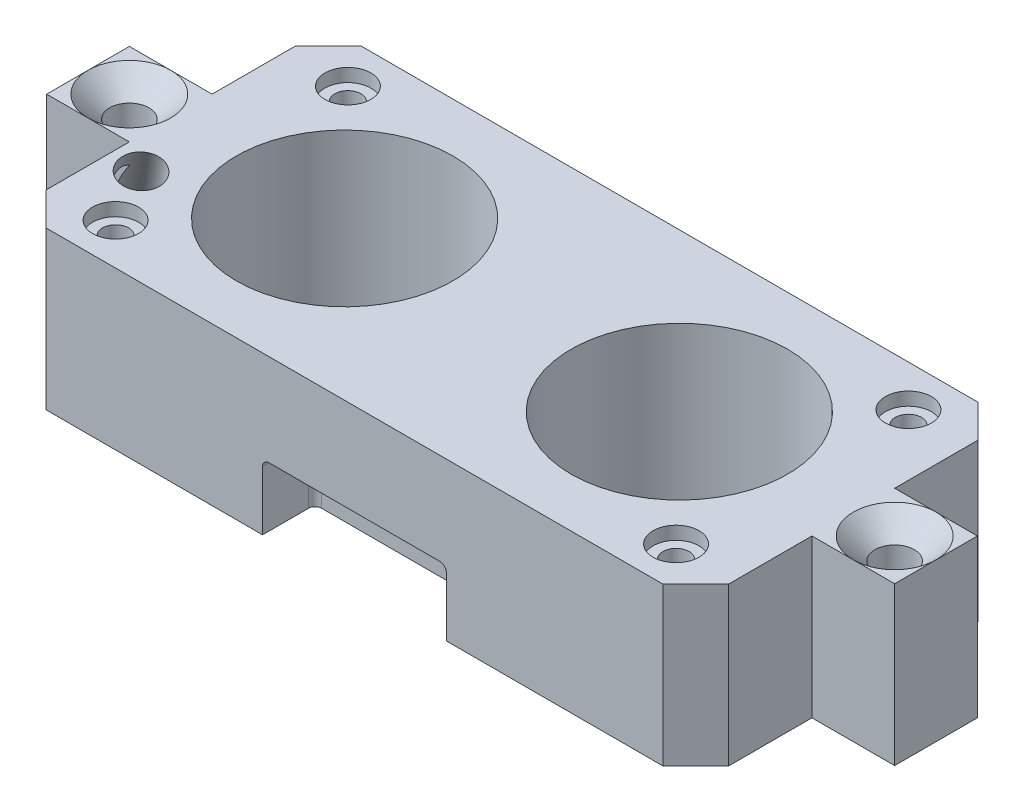
from build123d import *

# Parameters (mm, degrees)
SKETCH1_W                     = 52
SKETCH1_H                     = 24
SKETCH1_R                     = 8.25
BOSS_EXTRUDE1_DEPTH           = 12
SKETCH2_R                     = 1
CUT_EXTRUDE1_DEPTH            = 32.048349393
SKETCH3_R                     = 1.75
CUT_EXTRUDE2_DEPTH            = 1
CUT_EXTRUDE3_DEPTH            = 5
FILLET3_R                     = 0.5
CHAMFER1_SIZE                 = 2.5
SKETCH5_W                     = 14
SKETCH5_H                     = 8
CUT_EXTRUDE4_DEPTH            = 5
FILLET4_R                     = 0.5
SKETCH6_W                     = 6.3
SKETCH6_H                     = 6.3
BOSS_EXTRUDE2_DEPTH           = 12
CSK_FOR_M3_SFHCS1_D           = 3
CSK_FOR_M3_SFHCS1_CSINK_D     = 6.3
CSK_FOR_M3_SFHCS1_CSINK_ANGLE = 90
CSK_FOR_M3_SFHCS2_D           = 3
CSK_FOR_M3_SFHCS2_DEPTH       = 109.998865618
CSK_FOR_M3_SFHCS2_CSINK_D     = 6.3
CSK_FOR_M3_SFHCS2_CSINK_ANGLE = 90


with BuildPart() as part:
    # Sketch1 → Boss-Extrude1 (new body)
    with BuildSketch(Plane(origin=(0, 0, 0), x_dir=(1, 0, 0), z_dir=(0, 1, 0))):
        Rectangle(SKETCH1_W, SKETCH1_H)
        with Locations(Location((12.75, 0, 0), (0, 0, 270))):
            Circle(SKETCH1_R, mode=Mode.SUBTRACT)
        with Locations(Location((-12.75, 0, 0), (0, 0, 270))):
            Circle(SKETCH1_R, mode=Mode.SUBTRACT)
    extrude(amount=BOSS_EXTRUDE1_DEPTH)

    # Sketch2 → Cut-Extrude1 (cut, through all)
    with BuildSketch(Plane(origin=(0, 12, 0), x_dir=(1, 0, 0), z_dir=(0, 1, 0))):
        with Locations(Location((-21.35, 8.85, 0), (0, 0, 270))):
            Circle(SKETCH2_R)
        with Locations(Location((21.35, 8.85, 0), (0, 0, 270))):
            Circle(SKETCH2_R)
        with Locations(Location((21.35, -8.85, 0), (0, 0, 270))):
            Circle(SKETCH2_R)
        with Locations(Location((-21.35, -8.85, 0), (0, 0, 270))):
            Circle(SKETCH2_R)
    extrude(amount=-CUT_EXTRUDE1_DEPTH, mode=Mode.SUBTRACT)

    # Sketch3 → Cut-Extrude2 (cut)
    with BuildSketch(Plane(origin=(0, 12, 0), x_dir=(1, 0, 0), z_dir=(0, 1, 0))):
        with Locations(Location((-21.35, 8.85, 0), (0, 0, 270))):
            Circle(SKETCH3_R)
        with Locations(Location((21.35, 8.85, 0), (0, 0, 270))):
            Circle(SKETCH3_R)
        with Locations(Location((21.35, -8.85, 0), (0, 0, 270))):
            Circle(SKETCH3_R)
        with Locations(Location((-21.35, -8.85, 0), (0, 0, 270))):
            Circle(SKETCH3_R)
    extrude(amount=-CUT_EXTRUDE2_DEPTH, mode=Mode.SUBTRACT)

    # Sketch4 → Cut-Extrude3 (cut)
    with BuildSketch(Plane.XZ):
        Polygon((-6, -5), (-6, -12), (6, -12), (6, -5), (0, -5), align=None)
    extrude(amount=-CUT_EXTRUDE3_DEPTH, mode=Mode.SUBTRACT)

    # Fillet3
    fillet3_edges = [part.edges().sort_by_distance(p)[0] for p in [
        (-6, 2.5, -5),
        (6, 5, -8.5),
        (6, 2.5, -5),
        (-6, 5, -8.5),
        (0, 5, -5),
    ]]
    fillet(fillet3_edges, radius=FILLET3_R)

    # Chamfer1
    chamfer1_edges = [part.edges().sort_by_distance(p)[0] for p in [
        (26, 6, 12),
        (-26, 6, 12),
        (-26, 6, -12),
        (26, 6, -12),
    ]]
    chamfer(chamfer1_edges, length=CHAMFER1_SIZE)

    # Sketch5 → Cut-Extrude4 (cut)
    with BuildSketch(Plane.XZ):
        with Locations((0, 12)):
            Rectangle(SKETCH5_W, SKETCH5_H)
    extrude(amount=-CUT_EXTRUDE4_DEPTH, mode=Mode.SUBTRACT)

    # Fillet4
    fillet4_edges = [part.edges().sort_by_distance(p)[0] for p in [
        (-7, 2.5, 8),
        (7, 5, 10),
        (0, 5, 8),
        (-7, 5, 10),
        (7, 2.5, 8),
    ]]
    fillet(fillet4_edges, radius=FILLET4_R)

    # Sketch6 → Boss-Extrude2 (add)
    with BuildSketch(Plane(origin=(0, 12, 0), x_dir=(1, 0, 0), z_dir=(0, 1, 0))):
        with Locations((-29.15, 0)):
            Rectangle(SKETCH6_W, SKETCH6_H)
        with Locations((29.15, 0)):
            Rectangle(SKETCH6_W, SKETCH6_H)
    extrude(amount=-BOSS_EXTRUDE2_DEPTH)

    # CSK for M3 SFHCS1 (through all)
    with Locations(Plane(origin=(1490.377712475, 12, 7.825775805), x_dir=(0.766044443118983, 0, -0.6427876096865334), z_dir=(0, 1, 0))):
        with Locations((-1114.335057549, 945.253960578), (-1158.995448583, 982.728478223)):
            CounterSinkHole(CSK_FOR_M3_SFHCS1_D / 2, CSK_FOR_M3_SFHCS1_CSINK_D / 2, counter_sink_angle=CSK_FOR_M3_SFHCS1_CSINK_ANGLE)

    # CSK for M3 SFHCS2
    with Locations(Plane(origin=(-1373.834887972, 567.783106147, 105.616816862), x_dir=(-0.6343091461006837, 0.5606811628058592, -0.5322485705454655), z_dir=(-0.42950668912891715, -0.8280317830099698, -0.3603989044362456))):
        with Locations((-1114.335057549, 945.253960578), (-1158.995448583, 982.728478223)):
            CounterSinkHole(CSK_FOR_M3_SFHCS2_D / 2, CSK_FOR_M3_SFHCS2_CSINK_D / 2, depth=CSK_FOR_M3_SFHCS2_DEPTH, counter_sink_angle=CSK_FOR_M3_SFHCS2_CSINK_ANGLE)


solid = part.part
